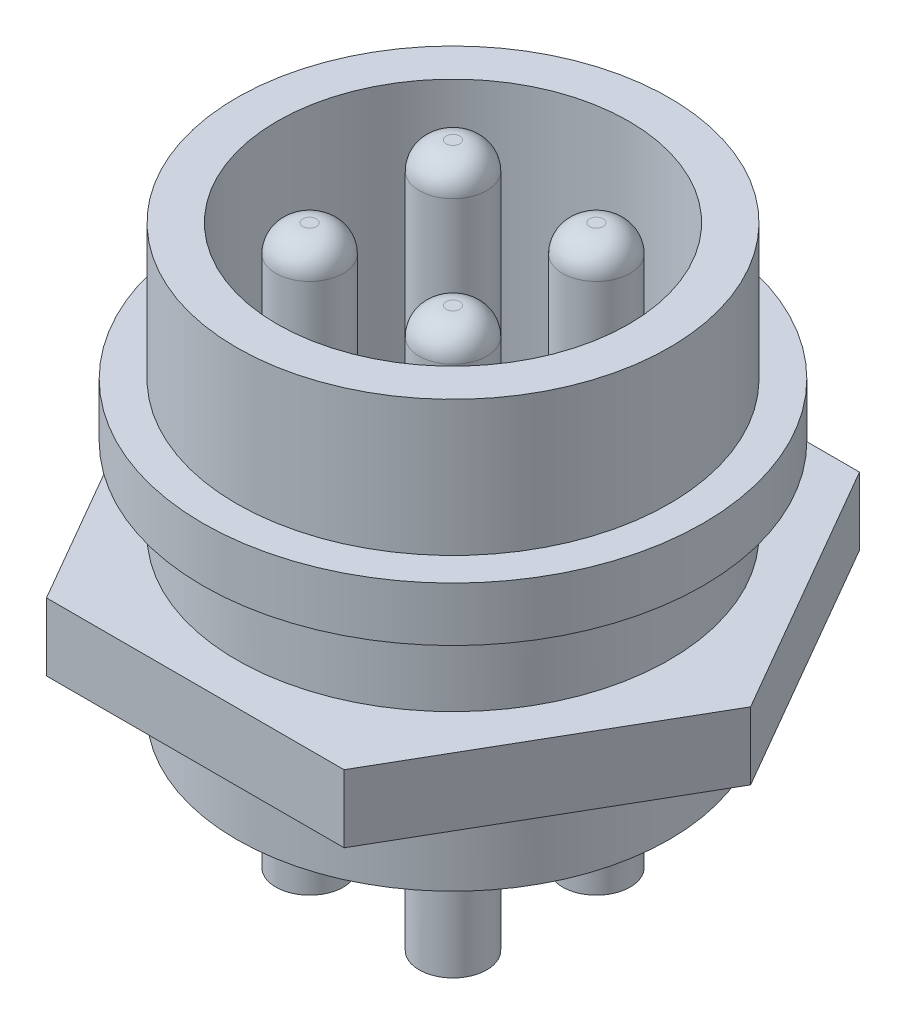
from build123d import *

# Parameters (mm, degrees)
SZKIC1_R                                = 8
DODANIE_WYCI_GNI_CIE1_DEPTH             = 15.75
SZKIC2_R                                = 6.5
WYTNIJ_WYCI_GNI_CIE1_DEPTH              = 10
DODANIE_WYCI_GNI_CIE2_START             = -2
SZKIC4_R                                = 9.25
SZKIC4_R_2                              = 8
DODANIE_WYCI_GNI_CIE2_DEPTH             = 2
SZKIC5_R                                = 1.25
DODANIE_WYCI_GNI_CIE3_DEPTH             = 4.9
DODANIE_WYCI_GNI_CIE3_DIRECTION_2_REACH = 27.08
ZAOKR_GLENIE1_R                         = 1
DODANIE_WYCI_GNI_CIE4_START             = 2.5
SZKIC6_R                                = 8
DODANIE_WYCI_GNI_CIE4_DEPTH             = 2.5


with BuildPart() as part:
    # Szkic1 → Dodanie-wyciągnięcie1 (new body)
    with BuildSketch(Plane(origin=(0, 0, 0), x_dir=(1, 0, 0), z_dir=(0, 1, 0))):
        with Locations(Location((-6.199930539, 2.677242733, 0), (0, 0, 270))):
            Circle(SZKIC1_R)
    extrude(amount=DODANIE_WYCI_GNI_CIE1_DEPTH)

    # Szkic2 → Wytnij-wyciągnięcie1 (cut)
    with BuildSketch(Plane(origin=(0, 15.75, 0), x_dir=(1, 0, 0), z_dir=(0, 1, 0))):
        with Locations(Location((-6.199930539, 2.677242733, 0), (0, 0, 270))):
            Circle(SZKIC2_R)
    extrude(amount=-WYTNIJ_WYCI_GNI_CIE1_DEPTH, mode=Mode.SUBTRACT)

    # Szkic4 → Dodanie-wyciągnięcie2 (add)
    with BuildSketch(Plane(origin=(0, 10.75, 0), x_dir=(1, 0, 0), z_dir=(0, 1, 0)).offset(DODANIE_WYCI_GNI_CIE2_START)):
        with Locations(Location((-6.199930539, 2.677242733, 0), (0, 0, 270))):
            Circle(SZKIC4_R)
        with Locations(Location((-6.199930539, 2.677242733, 0), (0, 0, 270))):
            Circle(SZKIC4_R_2, mode=Mode.SUBTRACT)
    extrude(amount=DODANIE_WYCI_GNI_CIE2_DEPTH)

    # Szkic5 → Dodanie-wyciągnięcie3 (add)
    with BuildSketch(Plane.XZ):
        with Locations(Location((-8.849930539, -0.027242733, 0), (0, 0, 270))):
            Circle(SZKIC5_R)
        with Locations(Location((-3.549930539, -0.027242733, 0), (0, 0, 270))):
            Circle(SZKIC5_R)
        with Locations(Location((-3.549930539, -5.327242733, 0), (0, 0, 270))):
            Circle(SZKIC5_R)
        with Locations(Location((-8.849930539, -5.327242733, 0), (0, 0, 270))):
            Circle(SZKIC5_R)
    extrude(amount=DODANIE_WYCI_GNI_CIE3_DEPTH)

    # Dodanie-wyciągnięcie3 direction 2: up to this face of the body (flat: up to its plane)
    dodanie_wyci_gni_cie3_direction_2_end = Plane(part.part.faces().sort_by_distance((-6.199930539, 15.75, -10.450968563))[0])
    # Szkic5 → Dodanie-wyciągnięcie3 direction 2 (add, up to the picked face)
    with BuildSketch(Plane.XZ, mode=Mode.PRIVATE) as dodanie_wyci_gni_cie3_direction_2_sk1:
        with Locations(Location((-8.849930539, -0.027242733, 0), (0, 0, 270))):
            Circle(SZKIC5_R)
    dodanie_wyci_gni_cie3_direction_2_tool1 = split(extrude(dodanie_wyci_gni_cie3_direction_2_sk1.sketch, amount=-DODANIE_WYCI_GNI_CIE3_DIRECTION_2_REACH, mode=Mode.PRIVATE), bisect_by=dodanie_wyci_gni_cie3_direction_2_end, keep=Keep.BOTH, mode=Mode.PRIVATE)
    # Szkic5 → Dodanie-wyciągnięcie3 direction 2 (add, up to the picked face)
    with BuildSketch(Plane.XZ, mode=Mode.PRIVATE) as dodanie_wyci_gni_cie3_direction_2_sk2:
        with Locations(Location((-3.549930539, -0.027242733, 0), (0, 0, 270))):
            Circle(SZKIC5_R)
    dodanie_wyci_gni_cie3_direction_2_tool2 = split(extrude(dodanie_wyci_gni_cie3_direction_2_sk2.sketch, amount=-DODANIE_WYCI_GNI_CIE3_DIRECTION_2_REACH, mode=Mode.PRIVATE), bisect_by=dodanie_wyci_gni_cie3_direction_2_end, keep=Keep.BOTH, mode=Mode.PRIVATE)
    # Szkic5 → Dodanie-wyciągnięcie3 direction 2 (add, up to the picked face)
    with BuildSketch(Plane.XZ, mode=Mode.PRIVATE) as dodanie_wyci_gni_cie3_direction_2_sk3:
        with Locations(Location((-3.549930539, -5.327242733, 0), (0, 0, 270))):
            Circle(SZKIC5_R)
    dodanie_wyci_gni_cie3_direction_2_tool3 = split(extrude(dodanie_wyci_gni_cie3_direction_2_sk3.sketch, amount=-DODANIE_WYCI_GNI_CIE3_DIRECTION_2_REACH, mode=Mode.PRIVATE), bisect_by=dodanie_wyci_gni_cie3_direction_2_end, keep=Keep.BOTH, mode=Mode.PRIVATE)
    # Szkic5 → Dodanie-wyciągnięcie3 direction 2 (add, up to the picked face)
    with BuildSketch(Plane.XZ, mode=Mode.PRIVATE) as dodanie_wyci_gni_cie3_direction_2_sk4:
        with Locations(Location((-8.849930539, -5.327242733, 0), (0, 0, 270))):
            Circle(SZKIC5_R)
    dodanie_wyci_gni_cie3_direction_2_tool4 = split(extrude(dodanie_wyci_gni_cie3_direction_2_sk4.sketch, amount=-DODANIE_WYCI_GNI_CIE3_DIRECTION_2_REACH, mode=Mode.PRIVATE), bisect_by=dodanie_wyci_gni_cie3_direction_2_end, keep=Keep.BOTH, mode=Mode.PRIVATE)
    add(dodanie_wyci_gni_cie3_direction_2_tool1.solids().sort_by(Axis((-8.849931, 0, -0.027243), (0, 1, 0)))[0])
    add(dodanie_wyci_gni_cie3_direction_2_tool2.solids().sort_by(Axis((-3.549931, 0, -0.027243), (0, 1, 0)))[0])
    add(dodanie_wyci_gni_cie3_direction_2_tool3.solids().sort_by(Axis((-3.549931, 0, -5.327243), (0, 1, 0)))[0])
    add(dodanie_wyci_gni_cie3_direction_2_tool4.solids().sort_by(Axis((-8.849931, 0, -5.327243), (0, 1, 0)))[0])

    # Zaokrąglenie1
    zaokr_glenie1_edges = [part.edges().sort_by_distance(p)[0] for p in [
        (-8.849930539, 15.75, 1.222757267),
        (-3.549930539, 15.75, 1.222757267),
        (-3.549930539, 15.75, -4.077242733),
        (-8.849930539, 15.75, -4.077242733),
    ]]
    fillet(zaokr_glenie1_edges, radius=ZAOKR_GLENIE1_R)

    # Szkic6 → Dodanie-wyciągnięcie4 (add)
    with BuildSketch(Plane(origin=(0, 5.75, 0), x_dir=(-1, 0, 0), z_dir=(0, -1, 0)).offset(DODANIE_WYCI_GNI_CIE4_START)):
        Polygon((17.202288313, 2.677242733), (11.701109426, 12.205564067), (0.698751652, 12.205564067), (-4.802427235, 2.677242733), (0.698751652, -6.851078601), (11.701109426, -6.851078601), align=None)
        with Locations(Location((6.199930539, 2.677242733, 0), (0, 0, 90))):
            Circle(SZKIC6_R, mode=Mode.SUBTRACT)
    extrude(amount=-DODANIE_WYCI_GNI_CIE4_DEPTH)


solid = part.part
